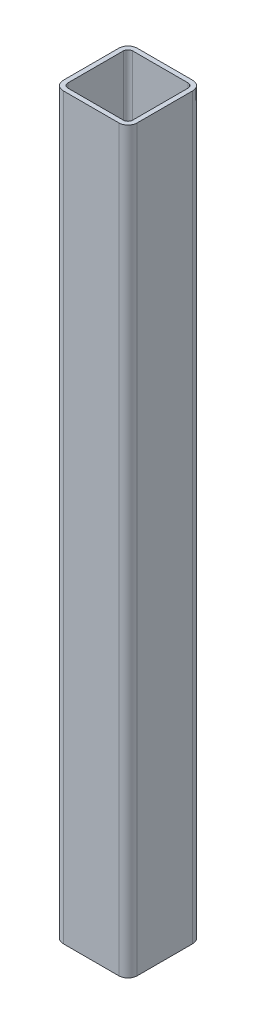
from build123d import *

# Parameters (mm, degrees)
KARE_T_P_80_X_80_X_5_1_DEPTH = 800


with BuildPart() as part:
    # Sketch12 → Kare tüp 80 X 80 X 5(1) (new body)
    with BuildSketch(Plane(origin=(0, 0, 0), x_dir=(-1, 0, 0), z_dir=(0, 1, 0))):
        with BuildLine():
            Line((-30, -40), (30, -40))
            ThreePointArc((30, -40), (37.071067812, -37.071067812), (40, -30))
            Line((40, -30), (40, 30))
            ThreePointArc((40, 30), (37.071067812, 37.071067812), (30, 40))
            Line((30, 40), (-30, 40))
            ThreePointArc((-30, 40), (-37.071067812, 37.071067812), (-40, 30))
            Line((-40, 30), (-40, -30))
            ThreePointArc((-40, -30), (-37.071067812, -37.071067812), (-30, -40))
        make_face()
        with BuildLine():
            Line((-30, -35), (30, -35))
            ThreePointArc((30, -35), (33.535533906, -33.535533906), (35, -30))
            Line((35, -30), (35, 30))
            ThreePointArc((35, 30), (33.535533906, 33.535533906), (30, 35))
            Line((30, 35), (-30, 35))
            ThreePointArc((-30, 35), (-33.535533906, 33.535533906), (-35, 30))
            Line((-35, 30), (-35, -30))
            ThreePointArc((-35, -30), (-33.535533906, -33.535533906), (-30, -35))
        make_face(mode=Mode.SUBTRACT)
    extrude(amount=KARE_T_P_80_X_80_X_5_1_DEPTH)


solid = part.part
